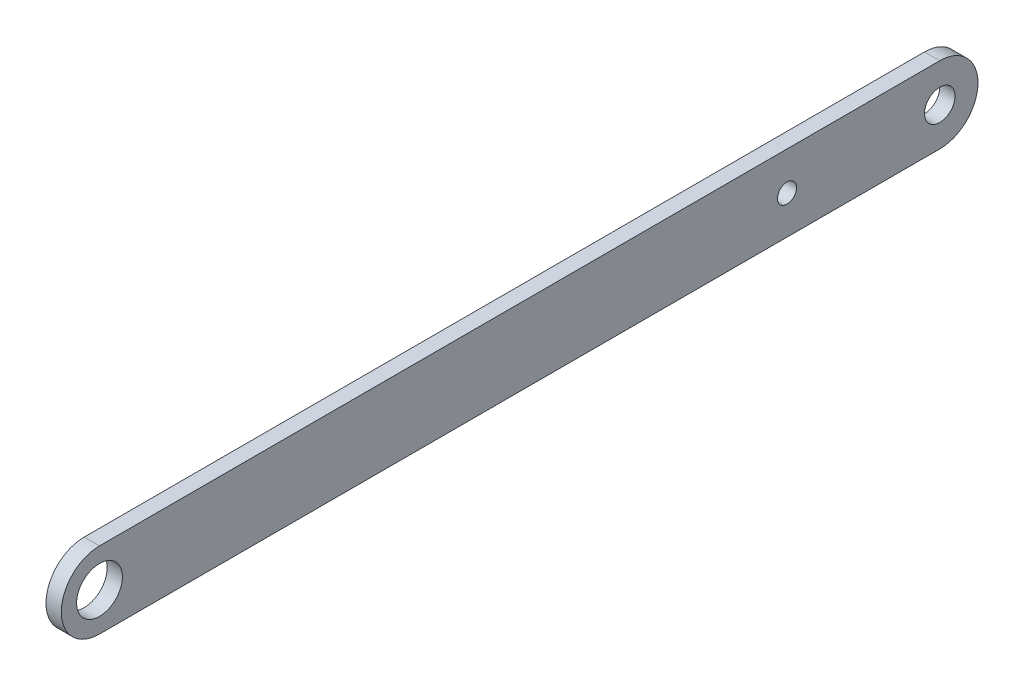
from build123d import *

# Parameters (mm, degrees)
SKETCH1_R           = 3
SKETCH1_R_2         = 2
SKETCH1_R_3         = 1.25
BOSS_EXTRUDE1_DEPTH = 2


with BuildPart() as part:
    # Sketch1 → Boss-Extrude1 (new body)
    with BuildSketch(Plane(origin=(0, 0, 0), x_dir=(0, 0, -1), z_dir=(1, 0, 0))):
        with BuildLine():
            Line((0, 0), (110, 0))
            ThreePointArc((110, 0), (115, 5), (110, 10))
            Line((110, 10), (0, 10))
            ThreePointArc((0, 10), (-5, 5), (0, 0))
        make_face()
        with Locations((0, 5)):
            Circle(SKETCH1_R, mode=Mode.SUBTRACT)
        with Locations((110, 5)):
            Circle(SKETCH1_R_2, mode=Mode.SUBTRACT)
        with Locations((90, 5)):
            Circle(SKETCH1_R_3, mode=Mode.SUBTRACT)
    extrude(amount=BOSS_EXTRUDE1_DEPTH)


solid = part.part
